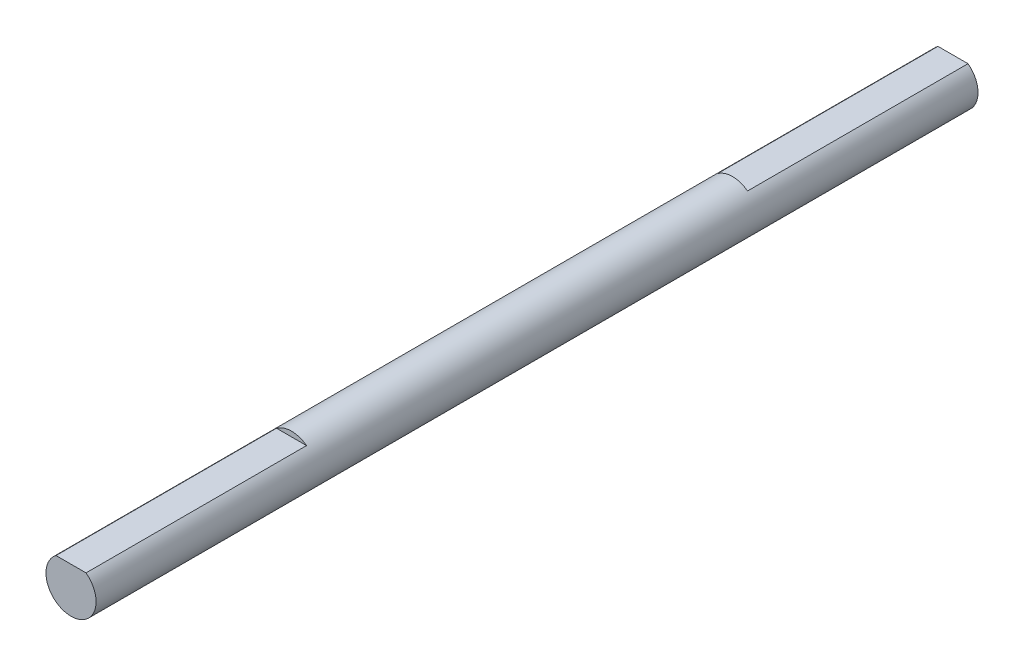
from build123d import *

# Parameters (mm, degrees)
SKETCH_1_R          = 2.5
EXTRUDE_1_DEPTH     = 88
CUT_EXTRUDE_1_DEPTH = 22


with BuildPart() as part:
    # 스케치1 → 보스-돌출1 (new body)
    with BuildSketch(Plane.XY):
        Circle(SKETCH_1_R)
    extrude(amount=EXTRUDE_1_DEPTH)

    # 스케치2 → 컷-돌출1 (cut)
    with BuildSketch(Plane(origin=(0, 0, 0), x_dir=(-1, 0, 0), z_dir=(0, 0, -1))):
        with BuildLine():
            Line((1.5, 2), (-1.5, 2))
            ThreePointArc((-1.5, 2), (0, 2.5), (1.5, 2))
        make_face()
    cut_extrude_1 = extrude(amount=-CUT_EXTRUDE_1_DEPTH, mode=Mode.SUBTRACT)

    # 대칭 복사1: 컷-돌출1 across plane
    add(cut_extrude_1.mirror(Plane(origin=(0, 0, 44), x_dir=(1, 0, 0), z_dir=(0, 0, -1))), mode=Mode.SUBTRACT)


solid = part.part
